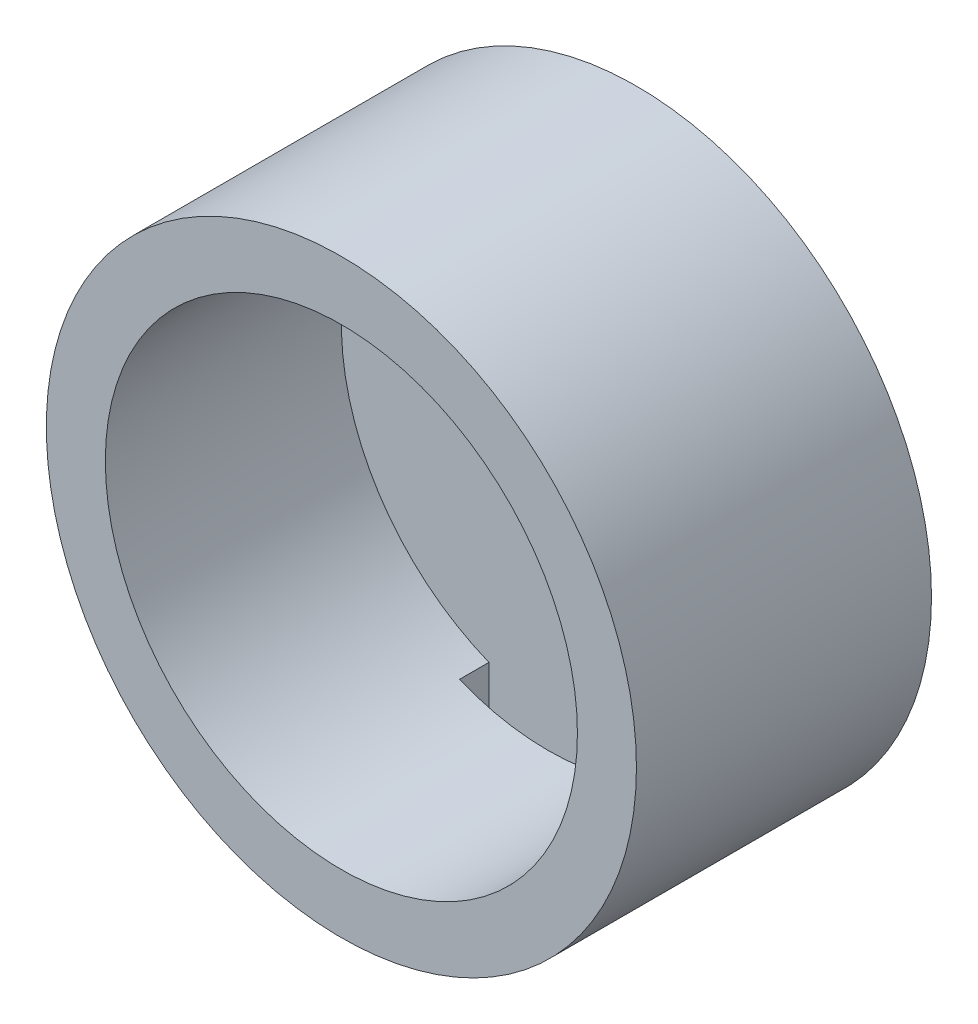
from build123d import *

# Parameters (mm, degrees)
SKETCH1_R           = 50
BOSS_EXTRUDE1_DEPTH = 50
SKETCH2_R           = 40
CUT_EXTRUDE1_DEPTH  = 40
SKETCH3_W           = 30
SKETCH3_H           = 5
CUT_EXTRUDE2_DEPTH  = 193


with BuildPart() as part:
    # Sketch1 → Boss-Extrude1 (new body)
    with BuildSketch(Plane.XY):
        Circle(SKETCH1_R)
    extrude(amount=BOSS_EXTRUDE1_DEPTH)

    # Sketch2 → Cut-Extrude1 (cut)
    with BuildSketch(Plane.XY.offset(50)):
        Circle(SKETCH2_R)
    extrude(amount=-CUT_EXTRUDE1_DEPTH, mode=Mode.SUBTRACT)

    # Sketch3 → Cut-Extrude2 (cut)
    with BuildSketch(Plane(origin=(0, 0, 0), x_dir=(1, 0, 0), z_dir=(0, 1, 0))):
        with Locations((0, -12.5)):
            Rectangle(SKETCH3_W, SKETCH3_H)
    extrude(amount=-CUT_EXTRUDE2_DEPTH, mode=Mode.SUBTRACT)


solid = part.part
